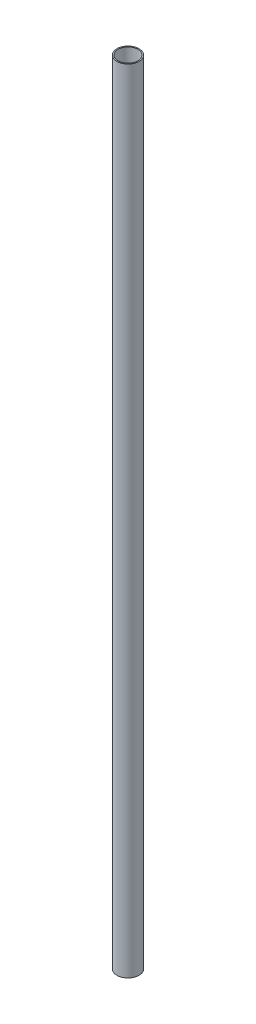
from build123d import *

# Parameters (mm, degrees)
SKETCH1_R           = 11
SKETCH1_R_2         = 9.9
BOSS_EXTRUDE1_DEPTH = 786.6


with BuildPart() as part:
    # Sketch1 → Boss-Extrude1 (new body)
    with BuildSketch(Plane(origin=(0, 0, 0), x_dir=(1, 0, 0), z_dir=(0, 1, 0))):
        with Locations(Location((0, 0, 0), (0, 0, 270))):
            Circle(SKETCH1_R)
        with Locations(Location((0, 0, 0), (0, 0, 270))):
            Circle(SKETCH1_R_2, mode=Mode.SUBTRACT)
    extrude(amount=BOSS_EXTRUDE1_DEPTH)


solid = part.part
